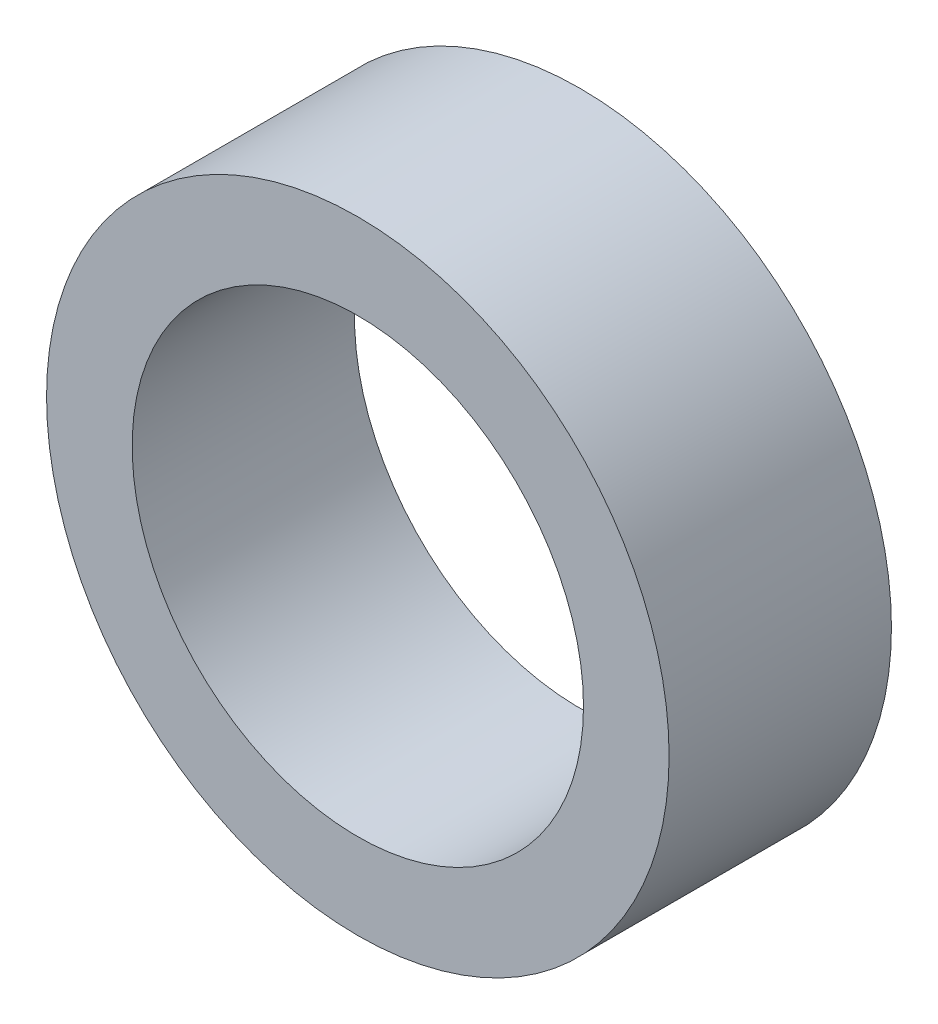
from build123d import *

# Parameters (mm, degrees)
SKETCH1_R           = 7
SKETCH1_R_2         = 5.075
BOSS_EXTRUDE1_DEPTH = 5


with BuildPart() as part:
    # Sketch1 → Boss-Extrude1 (new body)
    with BuildSketch(Plane.XY):
        Circle(SKETCH1_R)
        Circle(SKETCH1_R_2, mode=Mode.SUBTRACT)
    extrude(amount=BOSS_EXTRUDE1_DEPTH)


solid = part.part
